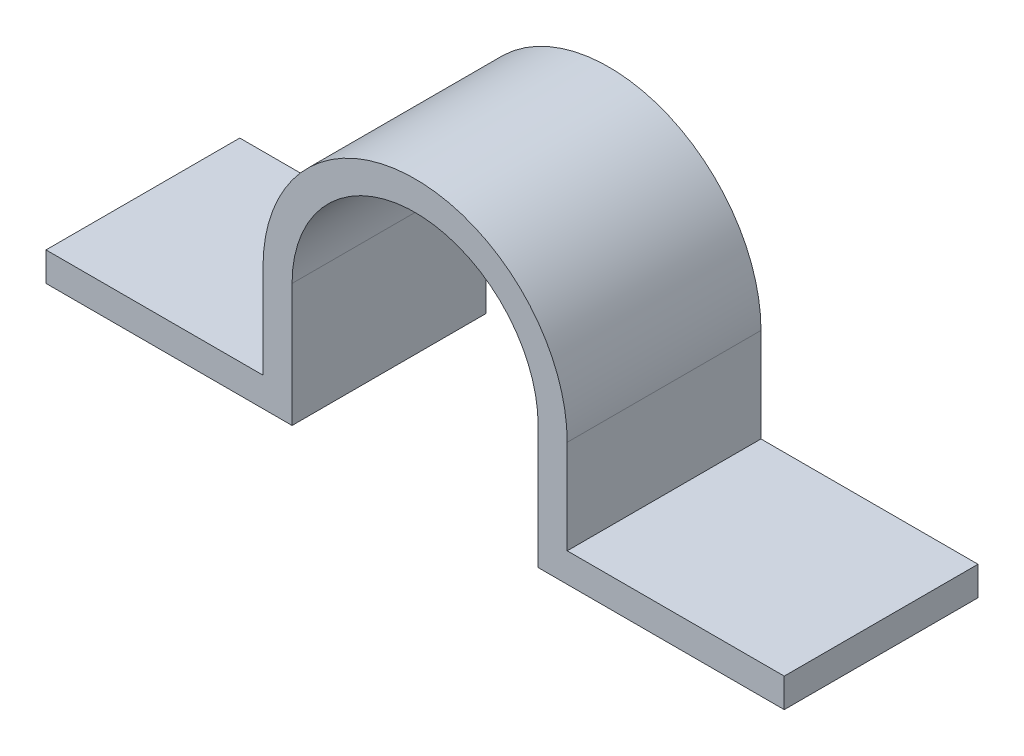
from build123d import *

# Parameters (mm, degrees)
EXTRUDE_THIN1_DEPTH = 20


with BuildPart() as part:
    # Sketch1 → Extrude-Thin1 (new body)
    with BuildSketch(Plane.XY):
        with BuildLine():
            Line((-38.1, 0), (-12.7, 0))
            Line((-12.7, 0), (-12.7, 12.7))
            ThreePointArc((-12.7, 12.7), (0, 25.4), (12.7, 12.7))
            Line((12.7, 12.7), (12.7, 0))
            Line((12.7, 0), (38.1, 0))
            Line((38.1, 0), (38.1, 3))
            Line((38.1, 3), (15.7, 3))
            Line((15.7, 3), (15.7, 12.7))
            ThreePointArc((15.7, 12.7), (0, 28.4), (-15.7, 12.7))
            Line((-15.7, 12.7), (-15.7, 3))
            Line((-15.7, 3), (-38.1, 3))
            Line((-38.1, 3), (-38.1, 0))
        make_face()
    extrude(amount=EXTRUDE_THIN1_DEPTH)


solid = part.part
